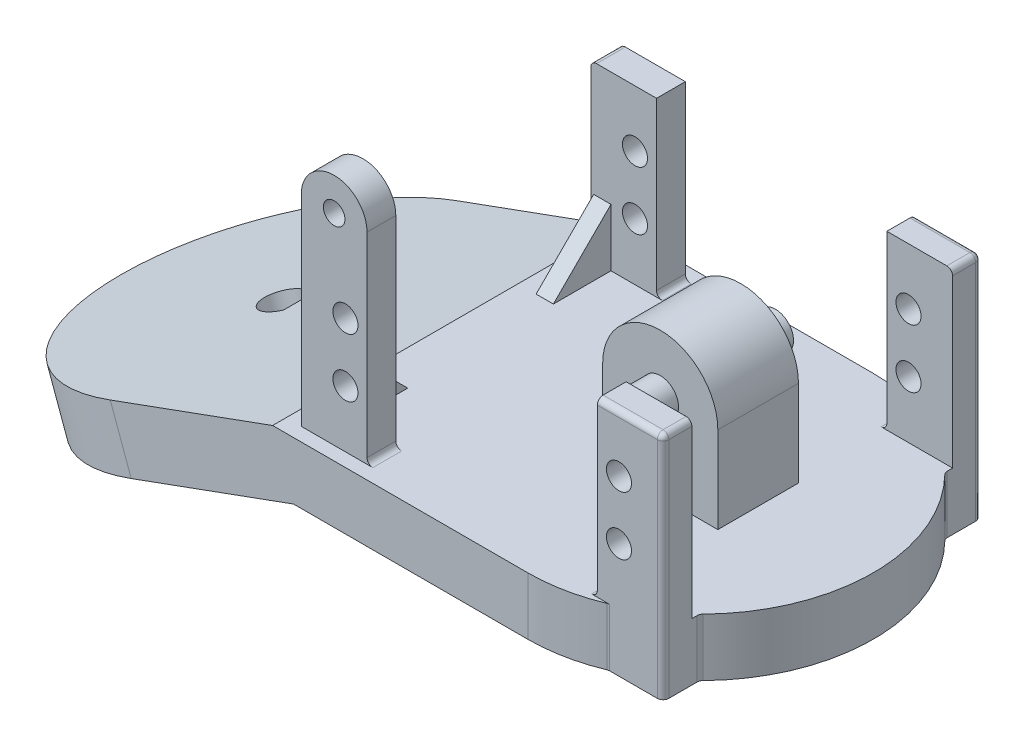
from build123d import *

# Parameters (mm, degrees)
BOSS_EXTRU_3_DEPTH       = 5
ESQUISSE7_R              = 3.175
BOSS_EXTRU_5_DEPTH       = 7
ESQUISSE13_R             = 2.18
BOSS_EXTRU_8_DEPTH       = 5
ENL_V_MAT_EXTRU_8_REACH  = 100.981
ESQUISSE47_W             = 40
ESQUISSE47_H             = 5
ESQUISSE33_W             = 9.466792894
ESQUISSE33_H             = 55.28
BOSS_EXTRU_10_DEPTH      = 10
ENL_V_MAT_EXTRU_6_DEPTH  = 65
ESQUISSE35_R             = 30
BOSS_EXTRU_11_DEPTH      = 5.32
BOSS_EXTRU_12_DEPTH      = 30
ENL_V_MAT_EXTRU_7_DEPTH  = 60
BOSS_EXTRU_13_DEPTH      = 5
NERVURE4_REACH           = 90.538
ESQUISSE45_WALL_W        = 193.218913386
ESQUISSE45_WALL_H        = 3
CONG_1_R                 = 1
CONG_2_R                 = 1
BOSS_EXTRU_14_DEPTH      = 13
BOSS_EXTRU_14_DEPTH_BACK = 13
ESQUISSE48_R             = 3.15


with BuildPart() as part:
    # Esquisse5 → Boss.-Extru.3 (new, symmetric)
    with BuildSketch(Plane(origin=(0, 0, 0), x_dir=(1, 0, 0), z_dir=(0, 1, 0))):
        with BuildLine():
            Line((42.5, -30), (-42.5, -30))
            ThreePointArc((-42.5, -30), (-72.5, 0), (-42.5, 30))
            Line((-42.5, 30), (42.5, 30))
            ThreePointArc((42.5, 30), (72.5, 0), (42.5, -30))
        make_face()
    extrude(amount=BOSS_EXTRU_3_DEPTH, both=True)

    # Esquisse7 → Boss.-Extru.5 (add, symmetric)
    with BuildSketch(Plane.XY):
        with BuildLine():
            Line((32.5, 5), (52.5, 5))
            Line((52.5, 5), (52.5, 20))
            ThreePointArc((52.5, 20), (42.5, 30), (32.5, 20))
            Line((32.5, 20), (32.5, 5))
        make_face()
        with Locations((42.5, 20)):
            Circle(ESQUISSE7_R, mode=Mode.SUBTRACT)
    extrude(amount=BOSS_EXTRU_5_DEPTH, both=True)

    # Esquisse13 → Boss.-Extru.8 (add)
    with BuildSketch(Plane.XY.offset(22.64)):
        Polygon((0.8, 5), (5.8, 5), (12.215, 5), (12.215, 29.91), (52.215, 29.91), (52.215, 5), (58.63, 5), (63.63, 5), (63.63, 34.91), (0.8, 34.91), align=None)
        with Locations((8.47, 14.92)):
            Circle(ESQUISSE13_R, mode=Mode.SUBTRACT)
        with Locations((55.97, 14.92)):
            Circle(ESQUISSE13_R, mode=Mode.SUBTRACT)
        with Locations((8.47, 25.08)):
            Circle(ESQUISSE13_R, mode=Mode.SUBTRACT)
        with Locations((55.97, 25.08)):
            Circle(ESQUISSE13_R, mode=Mode.SUBTRACT)
    boss_extru_8 = extrude(amount=BOSS_EXTRU_8_DEPTH)

    # Esquisse47 → Enlèv. mat.-Extru.8 (cut, up to next)
    with BuildSketch(Plane.XY.offset(27.64), mode=Mode.PRIVATE) as enl_v_mat_extru_8_sk1:
        with Locations((32.215, 32.41)):
            Rectangle(ESQUISSE47_W, ESQUISSE47_H)
    enl_v_mat_extru_8_tool1 = extrude(enl_v_mat_extru_8_sk1.sketch, amount=-ENL_V_MAT_EXTRU_8_REACH, mode=Mode.PRIVATE) & part.part
    enl_v_mat_extru_8 = enl_v_mat_extru_8_tool1.solids().sort_by_distance((32.215, 32.41, 27.64))[0]
    add(enl_v_mat_extru_8, mode=Mode.SUBTRACT)

    # Symétrie2: Boss.-Extru.8, Enlèv. mat.-Extru.8 across plane
    add(boss_extru_8.mirror(Plane.XY))
    add(enl_v_mat_extru_8.mirror(Plane.XY), mode=Mode.SUBTRACT)

    # Esquisse33 → Boss.-Extru.10 (add)
    with BuildSketch(Plane.XZ.offset(-5)):
        with Locations((58.896603553, 0)):
            Rectangle(ESQUISSE33_W, ESQUISSE33_H)
    extrude(amount=BOSS_EXTRU_10_DEPTH)

    # Esquisse36 → Enlèv. mat.-Extru.6 (cut, symmetric)
    with BuildSketch(Plane.XY):
        Polygon((0, 0), (9.099255857, -25), (-112.5, -25), (-112.5, 35), (-12.738958199, 35), align=None)
    extrude(amount=ENL_V_MAT_EXTRU_6_DEPTH, both=True, mode=Mode.SUBTRACT)



with BuildPart() as body_2:
    # Esquisse35 → Boss.-Extru.11 (new, symmetric)
    with BuildSketch(Plane(origin=(0, 0, 0), x_dir=(0, 0, -1), z_dir=(-0.34202014332566977, 0.939692620785908, 0))):
        with Locations(Location((0, 30, 0), (0, 0, 90))):
            Circle(ESQUISSE35_R)
    extrude(amount=BOSS_EXTRU_11_DEPTH, both=True)


with BuildPart() as part_1:
    add(part.part)

    add(body_2.part)  # Boss.-Extru.12 merges body 2
    # Esquisse40 → Boss.-Extru.12 (add, symmetric)
    with BuildSketch(Plane.XY):
        Polygon((-26.371231461, -15.259769042), (-30.010325786, -5.261439557), (-1.819547162, 4.999164743), (1.819547162, -4.999164743), align=None)
    extrude(amount=BOSS_EXTRU_12_DEPTH, both=True)

    # Esquisse41 → Enlèv. mat.-Extru.7 (cut)
    with BuildSketch(Plane(origin=(-1.819547162, 4.999164743, 0), x_dir=(0.939692620785908, 0.3420201433256698, 0), z_dir=(-0.3420201433256698, 0.9396926207859081, 0))):
        with BuildLine():
            Line((-27.46, -2.260176984), (-27.46, 2.260176984))
            ThreePointArc((-27.46, 2.260176984), (-33.4, 0), (-27.46, -2.260176984))
        make_face()
    extrude(amount=-ENL_V_MAT_EXTRU_7_DEPTH, mode=Mode.SUBTRACT)

    # Esquisse42 → Boss.-Extru.13 (add)
    with BuildSketch(Plane.XY.offset(27.64)):
        with BuildLine():
            Line((0.8, 39.91), (0.8, 34.91))
            Line((0.8, 34.91), (12.215, 34.91))
            Line((12.215, 34.91), (12.215, 39.91))
            Line((12.215, 39.91), (8.3825, 39.91))
            ThreePointArc((8.3825, 39.91), (6.5075, 38.035), (4.6325, 39.91))
            Line((4.6325, 39.91), (0.8, 39.91))
        make_face()
        with BuildLine():
            ThreePointArc((12.215, 39.91), (6.5075, 45.6175), (0.8, 39.91))
            Line((0.8, 39.91), (4.6325, 39.91))
            ThreePointArc((4.6325, 39.91), (6.5075, 41.785), (8.3825, 39.91))
            Line((8.3825, 39.91), (12.215, 39.91))
        make_face()
    extrude(amount=-BOSS_EXTRU_13_DEPTH)

    # Esquisse45 wall → Nervure4 (add, up to next)
    with BuildSketch(Plane(origin=(2.8, 9.999582371, 17.640000004), x_dir=(0, -0.707106781505, -0.707106780868), z_dir=(0, -0.707106780868, 0.707106781505)), mode=Mode.PRIVATE) as nervure4_sk1:
        Rectangle(ESQUISSE45_WALL_W, ESQUISSE45_WALL_H)
    nervure4_tool1 = extrude(nervure4_sk1.sketch, amount=NERVURE4_REACH, mode=Mode.PRIVATE) - part_1.part
    nervure4 = nervure4_tool1.solids().sort_by_distance((2.8, 9.999582371, 17.640000004))[0]
    add(nervure4)

    # Congé1
    cong_1_edges = [part_1.edges().sort_by_distance(p)[0] for p in [
        (54.163207106, 0, 27.64),
        (63.63, 14.955, -27.64),
        (54.163207106, 0, -27.64),
        (63.63, 14.955, 27.64),
        (63.63, 0, 21.296081799),
        (63.63, 0, -21.296081799),
    ]]
    fillet(cong_1_edges, radius=CONG_1_R)

    # Symétrie3: Nervure4 across plane
    add(nervure4.mirror(Plane.XY))

    # Congé2
    cong_2_edges = [part_1.edges().sort_by_distance(p)[0] for p in [
        (63.63, 34.91, 24.64),
        (63.337106781, 34.91, 27.347106781),
        (63.63, 34.91, -24.64),
        (63.337106781, 34.91, -27.347106781),
        (0.8, 34.91, -25.14),
        (52.215, 5, 25.14),
        (12.215, 5, -25.14),
        (57.4225, 34.91, 27.64),
        (12.215, 5, 25.14),
        (52.215, 5, -25.14),
    ]]
    fillet(cong_2_edges, radius=CONG_2_R)


with BuildPart() as body_2_2:
    # Esquisse48 → Boss.-Extru.14 (new, two sides: drawn at the far end of the back side and taken through both)
    with BuildSketch(Plane.XY.offset(-BOSS_EXTRU_14_DEPTH_BACK)):
        with Locations((42.5, 20)):
            Circle(ESQUISSE48_R)
    extrude(amount=BOSS_EXTRU_14_DEPTH + BOSS_EXTRU_14_DEPTH_BACK)


solid = Compound([part_1.part, body_2_2.part])
